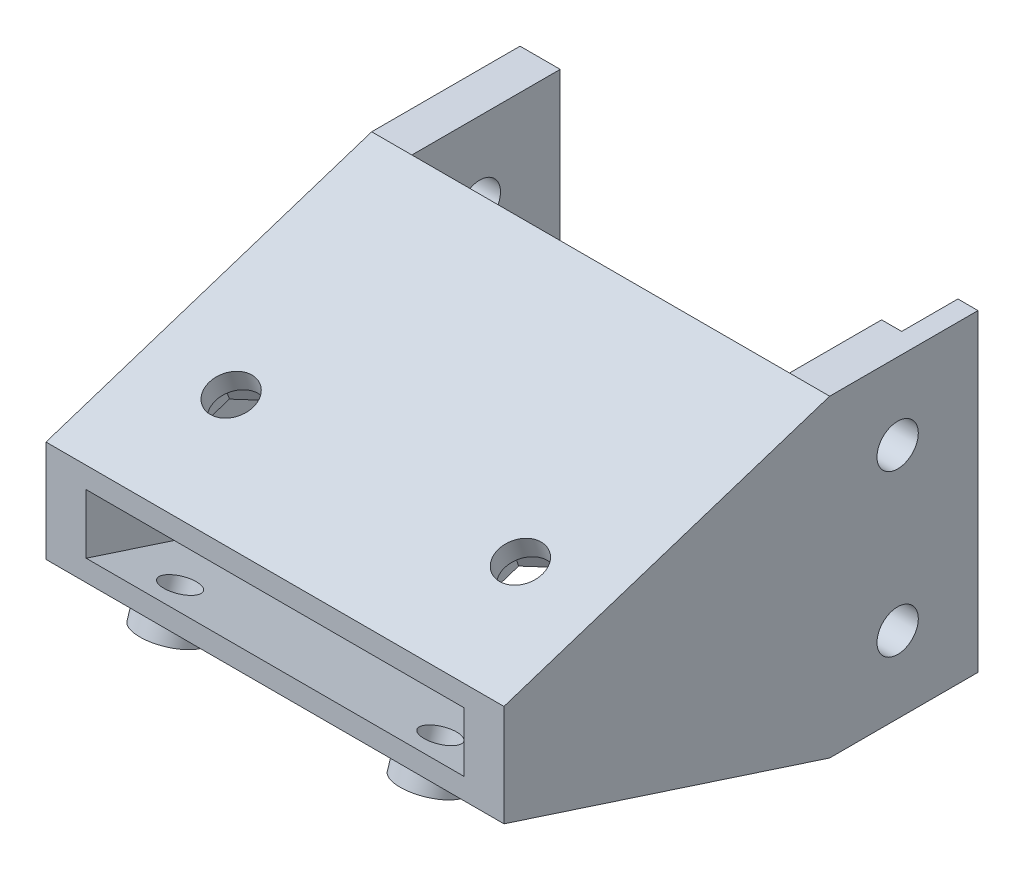
from build123d import *

# Parameters (mm, degrees)
SKETCH1_W                      = 36.195
SKETCH1_H                      = 24.765
BOSS_EXTRUDE1_DEPTH            = 43.815
SKETCH2_W                      = 29.845
SKETCH2_H                      = 24.765
CUT_EXTRUDE2_DEPTH             = 49.99591858
BOSS_EXTRUDE2_DEPTH            = 29.845
CUT_EXTRUDE3_DEPTH             = 57.244119081
CUT_EXTRUDE3_DEPTH_BACK        = 57.244119081
SKETCH15_R                     = 2.413
BOSS_EXTRUDE4_DEPTH            = 1.27
F_2_CLEARANCE_HOLE1_D          = 2.7051
F_2_CLEARANCE_HOLE1_DEPTH      = 5.334
F_2_CLEARANCE_HOLE1_TIP        = 0.81269403
SKETCH5_R                      = 0.5715
SKETCH5_W                      = 20.32
SKETCH5_H                      = 8.396837385
CUT_EXTRUDE4_DEPTH             = 1.5875
F_4_CLEARANCE_HOLE1_AT_2_COUNT = 2
F_4_CLEARANCE_HOLE1_AT_2_PITCH = 12.7
SKETCH8_W                      = 6.35
SKETCH8_H                      = 24.765
CUT_EXTRUDE5_DEPTH             = 59.461124747
SKETCH12_W                     = 8.89
SKETCH12_H                     = 8.89
BOSS_EXTRUDE3_DEPTH            = 2.54
F_4_CLEARANCE_HOLE2_D          = 3.4544
F_4_CLEARANCE_HOLE2_DEPTH      = 4.1275
CUT_EXTRUDE7_DEPTH             = 2.54
SKETCH18_W                     = 1.5875
SKETCH18_H                     = 6.35
CUT_EXTRUDE8_DEPTH             = 4.445


with BuildPart() as part:
    # Sketch1 → Boss-Extrude1 (new body)
    with BuildSketch(Plane.XY):
        Rectangle(SKETCH1_W, SKETCH1_H)
    extrude(amount=BOSS_EXTRUDE1_DEPTH)

    # Sketch2 → Cut-Extrude2 (cut, through all)
    with BuildSketch(Plane(origin=(0, 0, 0), x_dir=(-1, 0, 0), z_dir=(0, 0, -1))):
        Rectangle(SKETCH2_W, SKETCH2_H)
    extrude(amount=-CUT_EXTRUDE2_DEPTH, mode=Mode.SUBTRACT)


with BuildPart() as cut_extrude2_piece_1:
    # of the separate pieces the step leaves, piece 1, a body of its own (cut_extrude2_pieces)
    add(part.part.solids().sort_by_distance((18.0975, 12.3825, 0))[0])



with BuildPart() as cut_extrude2_piece_2:
    # of the separate pieces the step leaves, piece 2, a body of its own (cut_extrude2_pieces)
    add(part.part.solids().sort_by_distance((-14.9225, 12.3825, 0))[0])


with BuildPart() as cut_extrude2_piece_1_1:
    add(cut_extrude2_piece_1.part)

    add(cut_extrude2_piece_2.part)  # Boss-Extrude2 merges Cut-Extrude2 piece 2
    # Sketch3 → Boss-Extrude2 (add)
    with BuildSketch(Plane(origin=(-14.9225, 0, 0), x_dir=(0, 0, -1), z_dir=(1, 0, 0))):
        Polygon((-43.815, -2.3495), (-43.815, -4.018696281), (-18.073858986, -12.3825), (-18.073858986, -10.713303719), align=None)
        Polygon((-18.073858986, 12.3825), (-18.073858986, 10.713303719), (-43.815, 2.3495), (-43.815, 4.018696281), align=None)
    extrude(amount=BOSS_EXTRUDE2_DEPTH)

    # Sketch4 → Cut-Extrude3 (cut, two sides: drawn at the far end of the back side and taken through both)
    with BuildSketch(Plane(origin=(-14.9225, 0, 0), x_dir=(0, 0, -1), z_dir=(1, 0, 0)).offset(-CUT_EXTRUDE3_DEPTH_BACK)):
        Polygon((-46.355, -3.193400253), (-10.119746729, -14.966947738), (-46.355, -14.966947738), align=None)
        Polygon((-46.355, 14.966947738), (-46.355, 3.193400253), (-10.119746729, 14.966947738), align=None)
    extrude(amount=CUT_EXTRUDE3_DEPTH + CUT_EXTRUDE3_DEPTH_BACK, mode=Mode.SUBTRACT)

    # Sketch15 → Boss-Extrude4 (add)
    with BuildSketch(Plane(origin=(0, -16.511850348, 5.365025399), x_dir=(1, 0, 0), z_dir=(0, -0.9510565162951556, 0.30901699437494146))):
        with Locations(Location((-10.287, 38.015695815, 0), (0, 0, 90))):
            Circle(SKETCH15_R)
        with Locations(Location((10.287, 38.015695815, 0), (0, 0, 90))):
            Circle(SKETCH15_R)
        with Locations(Location((10.287, 25.569695815, 0), (0, 0, 90))):
            Circle(SKETCH15_R)
        with Locations(Location((-10.287, 25.569695815, 0), (0, 0, 90))):
            Circle(SKETCH15_R)
    extrude(amount=BOSS_EXTRUDE4_DEPTH)

    # #2 Clearance Hole1
    with Locations(Plane(origin=(0, -17.719692124, 5.757476982), x_dir=(-1, 0, 0), z_dir=(0, -0.9510565162951556, 0.3090169943749415))):
        with Locations((10.287, -25.569695815), (10.287, -38.015695815), (-10.287, -38.015695815), (-10.287, -25.569695815)):
            Hole(F_2_CLEARANCE_HOLE1_D / 2, depth=F_2_CLEARANCE_HOLE1_DEPTH)
            with Locations((0, 0, -(F_2_CLEARANCE_HOLE1_DEPTH + F_2_CLEARANCE_HOLE1_TIP / 2))):  # 118° drill point
                Cone(0, F_2_CLEARANCE_HOLE1_D / 2, F_2_CLEARANCE_HOLE1_TIP, mode=Mode.SUBTRACT)

    # Sketch5 → Cut-Extrude4 (cut)
    with BuildSketch(Plane(origin=(0, -16.511850348, 5.365025399), x_dir=(1, 0, 0), z_dir=(0, -0.9510565162951556, 0.30901699437494146))):
        with Locations((-10.287, 38.015695815)):
            Circle(SKETCH5_R)
        with Locations((10.287, 38.015695815)):
            Circle(SKETCH5_R)
        with Locations((10.287, 25.569695815)):
            Circle(SKETCH5_R)
        with Locations((-10.287, 25.569695815)):
            Circle(SKETCH5_R)
        with Locations((0, 17.561277123)):
            Rectangle(SKETCH5_W, SKETCH5_H)
    extrude(amount=-CUT_EXTRUDE4_DEPTH, mode=Mode.SUBTRACT)

    # Sketch6 → #4 Clearance Hole1 (revolve, cut)
    with BuildSketch(Plane(origin=(14.9225, 6.35, 12.7), x_dir=(0, 0, 1), z_dir=(0, 1, 0))):
        Polygon((0, 0), (0, 10.886574487), (1.63195, 9.906), (1.63195, 0), align=None)
    f_4_clearance_hole1 = revolve(axis=Axis((8.5725, 6.35, 12.7), (1, 0, 0)), mode=Mode.SUBTRACT)

    # #4 Clearance Hole1 at 2: #4 Clearance Hole1 ×2
    with Locations(*[(0, -i * F_4_CLEARANCE_HOLE1_AT_2_PITCH, 0) for i in range(1, F_4_CLEARANCE_HOLE1_AT_2_COUNT)]):
        add(f_4_clearance_hole1, mode=Mode.SUBTRACT)

    # Mirror2: #4 Clearance Hole1 across plane
    add(f_4_clearance_hole1.mirror(Plane(origin=(0, 0, 0), x_dir=(0, 0, 1), z_dir=(1, 0, 0))), mode=Mode.SUBTRACT)

    # Mirror2 copy 1 sketch → Mirror2 copy 1 (revolve, cut)
    with BuildSketch(Plane(origin=(-14.9225, -6.35, 12.7), x_dir=(0, 0, 1), z_dir=(0, 1, 0))):
        Polygon((0, 0), (0, -10.886574487), (1.63195, -9.906), (1.63195, 0), align=None)
    revolve(axis=Axis((-8.5725, -6.35, 12.7), (1, 0, 0)), mode=Mode.SUBTRACT)

    # Sketch8 → Cut-Extrude5 (cut, through all)
    with BuildSketch(Plane.ZY.offset(18.0975)):
        with Locations((3.175, 0)):
            Rectangle(SKETCH8_W, SKETCH8_H)
    extrude(amount=-CUT_EXTRUDE5_DEPTH, mode=Mode.SUBTRACT)

    # Sketch12 → Boss-Extrude3 (add)
    with BuildSketch(Plane(origin=(0, 15.002048129, 4.874460921), x_dir=(-1, 0, 0), z_dir=(0, -0.9510565162951555, -0.30901699437494146))):
        with Locations((-10.4775, -32.054505833)):
            Rectangle(SKETCH12_W, SKETCH12_H)
        with Locations((10.4775, -32.054505833)):
            Rectangle(SKETCH12_W, SKETCH12_H)
    extrude(amount=BOSS_EXTRUDE3_DEPTH)

    # #4 Clearance Hole2
    with Locations(Plane(origin=(0, 16.511850348, 5.365025399), x_dir=(1, 0, 0), z_dir=(0, 0.9510565162951555, 0.30901699437494157))):
        with Locations((-11.43, -32.054505833), (11.43, -32.054505833)):
            Hole(F_4_CLEARANCE_HOLE2_D / 2, depth=F_4_CLEARANCE_HOLE2_DEPTH)

    # Sketch13 → Cut-Extrude7 (cut)
    with BuildSketch(Plane(origin=(0, 12.586364577, 4.089557755), x_dir=(-1, 0, 0), z_dir=(0, -0.9510565162951554, -0.3090169943749416))):
        Polygon((-8.2931, -33.865595893), (-8.2931, -30.243415774), (-11.43, -28.432325714), (-14.5669, -30.243415774), (-14.5669, -33.865595893), (-11.43, -35.676685952), align=None)
        Polygon((8.2931, -33.865595893), (11.43, -35.676685952), (14.5669, -33.865595893), (14.5669, -30.243415774), (11.43, -28.432325714), (8.2931, -30.243415774), align=None)
    extrude(amount=-CUT_EXTRUDE7_DEPTH, mode=Mode.SUBTRACT)

    # Sketch18 → Cut-Extrude8 (cut)
    with BuildSketch(Plane(origin=(0, 0, 6.35), x_dir=(-1, 0, 0), z_dir=(0, 0, -1))):
        with Locations((-15.71625, 9.2075)):
            Rectangle(SKETCH18_W, SKETCH18_H)
        with Locations((15.71625, -9.2075)):
            Rectangle(SKETCH18_W, SKETCH18_H)
    extrude(amount=-CUT_EXTRUDE8_DEPTH, mode=Mode.SUBTRACT)


solid = cut_extrude2_piece_1_1.part
